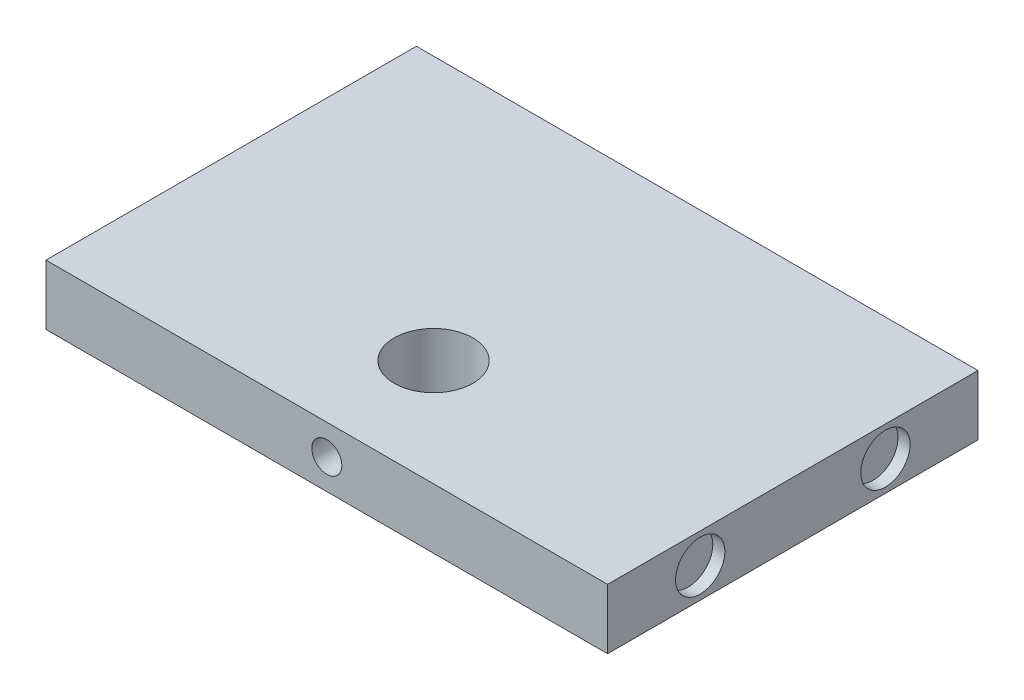
from build123d import *

# Parameters (mm, degrees)
CROQUIS1_W                 = 93.4
CROQUIS1_H                 = 61.6
CROQUIS1_R                 = 6.55
SALIENTE_EXTRUIR1_DEPTH    = 10
CROQUIS2_R                 = 4.1
CORTAR_EXTRUIR1_DEPTH      = 2
CORTAR_EXTRUIR2_REACH      = 79.945
CORTAR_EXTRUIR2_END_RADIUS = 6.55
CROQUIS3_R                 = 2.5


with BuildPart() as part:
    # Croquis1 → Saliente-Extruir1 (new body)
    with BuildSketch(Plane(origin=(0, 0, 0), x_dir=(1, 0, 0), z_dir=(0, 1, 0))):
        Rectangle(CROQUIS1_W, CROQUIS1_H)
        with Locations(Location((0, -13.05, 0), (0, 0, 270))):
            Circle(CROQUIS1_R, mode=Mode.SUBTRACT)
    extrude(amount=SALIENTE_EXTRUIR1_DEPTH)

    # Croquis2 → Cortar-Extruir1 (cut)
    with BuildSketch(Plane.ZY.offset(46.7)):
        with Locations((-15.4, 5)):
            Circle(CROQUIS2_R)
        with Locations(Location((15.4, 5, 0), (0, 0, 180))):
            Circle(CROQUIS2_R)
    cortar_extruir1 = extrude(amount=-CORTAR_EXTRUIR1_DEPTH, mode=Mode.SUBTRACT)

    # Simetría2: Cortar-Extruir1 across plane
    add(cortar_extruir1.mirror(Plane(origin=(0, 0, 0), x_dir=(0, 0, 1), z_dir=(1, 0, 0))), mode=Mode.SUBTRACT)

    # Cortar-Extruir2: up to this cylinder (the profile starts outside it)
    cortar_extruir2_end = Plane(origin=(0, 5, 13.05), z_dir=(0, -1, 0)) * Cylinder(CORTAR_EXTRUIR2_END_RADIUS, 173.99, mode=Mode.PRIVATE)
    # Croquis3 → Cortar-Extruir2 (cut, up to the surface)
    with BuildSketch(Plane.XY.offset(30.8), mode=Mode.PRIVATE) as cortar_extruir2_sk1:
        with Locations((0, 5)):
            Circle(CROQUIS3_R)
    cortar_extruir2_tool1 = extrude(cortar_extruir2_sk1.sketch, amount=-CORTAR_EXTRUIR2_REACH, mode=Mode.PRIVATE) - cortar_extruir2_end
    add(cortar_extruir2_tool1.solids().sort_by_distance((0, 5, 30.8))[0], mode=Mode.SUBTRACT)


solid = part.part
